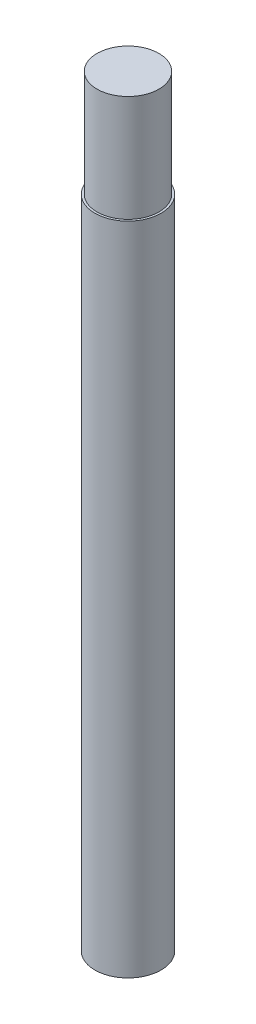
from build123d import *

# Parameters (mm, degrees)
SKETCH1_R           = 7.89305
BOSS_EXTRUDE1_DEPTH = 156.4386
SKETCH2_R           = 7.38505
BOSS_EXTRUDE2_DEPTH = 25.4


with BuildPart() as part:
    # Sketch1 → Boss-Extrude1 (new body)
    with BuildSketch(Plane(origin=(0, 0, 0), x_dir=(1, 0, 0), z_dir=(0, 1, 0))):
        with Locations(Location((0, 0, 0), (0, 0, 270))):
            Circle(SKETCH1_R)
    extrude(amount=BOSS_EXTRUDE1_DEPTH)

    # Sketch2 → Boss-Extrude2 (add)
    with BuildSketch(Plane(origin=(0, 156.4386, 0), x_dir=(1, 0, 0), z_dir=(0, 1, 0))):
        with Locations(Location((0, 0, 0), (0, 0, 270))):
            Circle(SKETCH2_R)
    extrude(amount=BOSS_EXTRUDE2_DEPTH)


solid = part.part
